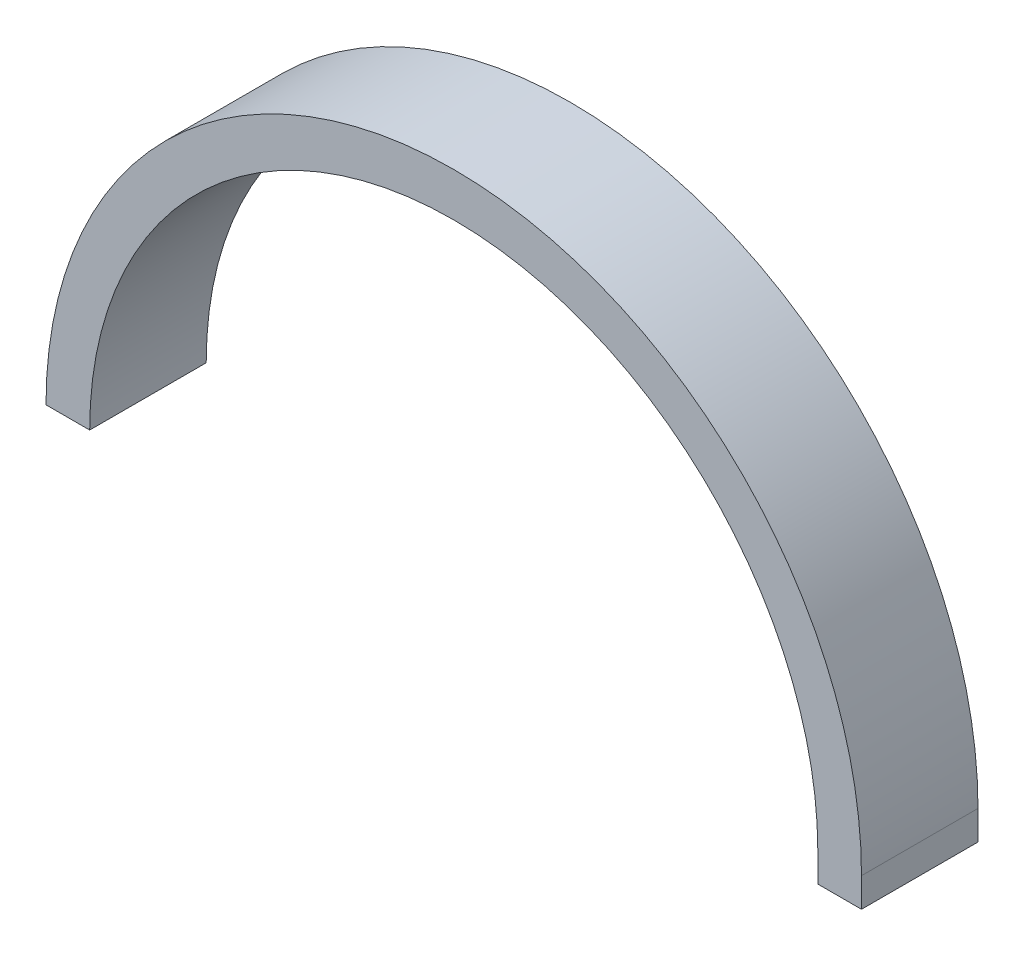
from build123d import *

# Parameters (mm, degrees)
EXTRUDE_1_DEPTH = 40
SKETCH_3_W      = 15
SKETCH_3_H      = 40
EXTRUDE_3_DEPTH = 10


with BuildPart() as part:
    # 草图1 → 凸台-拉伸1 (new body)
    with BuildSketch(Plane.XY):
        with BuildLine():
            Line((-125, 0), (-140, 0))
            ThreePointArc((-140, 0), (0, 140), (140, 0))
            Line((140, 0), (125, 0))
            ThreePointArc((125, 0), (0, 125), (-125, 0))
        make_face()
    extrude(amount=EXTRUDE_1_DEPTH)

    # 草图3 → 凸台-拉伸3 (add)
    with BuildSketch(Plane.XZ):
        with Locations((132.5, 20)):
            Rectangle(SKETCH_3_W, SKETCH_3_H)
    extrude(amount=EXTRUDE_3_DEPTH)


solid = part.part
